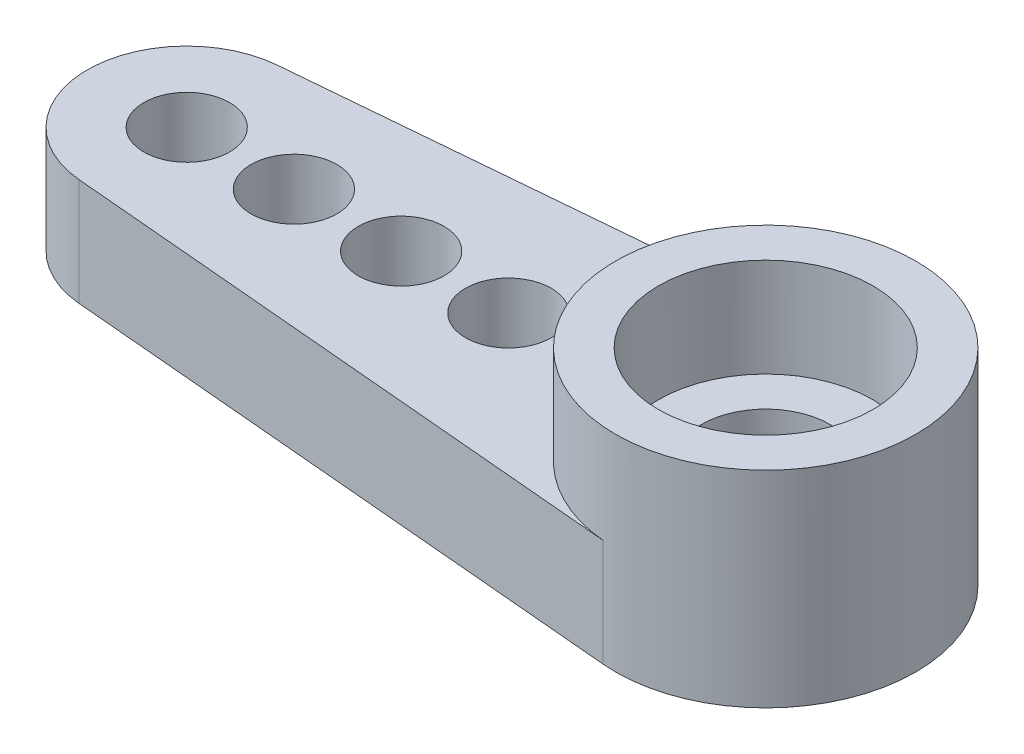
from build123d import *

# Parameters (mm, degrees)
SKETCH_1_R      = 3.5
SKETCH_1_R_2    = 2.5
EXTRUDE_1_DEPTH = 4.8
SKETCH_2_R      = 1.5
SKETCH_2_R_2    = 1
EXTRUDE_2_DEPTH = 2.5


with BuildPart() as part:
    # 草图1 → 凸台-拉伸1 (new body)
    with BuildSketch(Plane(origin=(0, 0, 0), x_dir=(1, 0, 0), z_dir=(0, 1, 0))):
        with Locations(Location((0, 0, 0), (0, 0, 270))):
            Circle(SKETCH_1_R)
        with Locations(Location((0, 0, 0), (0, 0, 270))):
            Circle(SKETCH_1_R_2, mode=Mode.SUBTRACT)
    extrude(amount=EXTRUDE_1_DEPTH)

    # 草图2 → 凸台-拉伸2 (add)
    with BuildSketch(Plane.XZ):
        with BuildLine():
            Line((-13.702785185, 2.311120544), (-0.305925926, 3.486604269))
            ThreePointArc((-0.305925926, 3.486604269), (3.5, 0), (-0.305925926, -3.486604269))
            Line((-0.305925926, -3.486604269), (-13.702785185, -2.311120544))
            ThreePointArc((-13.702785185, -2.311120544), (-15.82, 0), (-13.702785185, 2.311120544))
        make_face()
        with Locations(Location((0, 0, 0), (0, 0, 270))):
            Circle(SKETCH_2_R, mode=Mode.SUBTRACT)
        with Locations(Location((-13.5, 0, 0), (0, 0, 270))):
            Circle(SKETCH_2_R_2, mode=Mode.SUBTRACT)
        with Locations(Location((-11, 0, 0), (0, 0, 270))):
            Circle(SKETCH_2_R_2, mode=Mode.SUBTRACT)
        with Locations(Location((-8.5, 0, 0), (0, 0, 270))):
            Circle(SKETCH_2_R_2, mode=Mode.SUBTRACT)
        with Locations(Location((-6, 0, 0), (0, 0, 270))):
            Circle(SKETCH_2_R_2, mode=Mode.SUBTRACT)
    extrude(amount=-EXTRUDE_2_DEPTH)


solid = part.part
